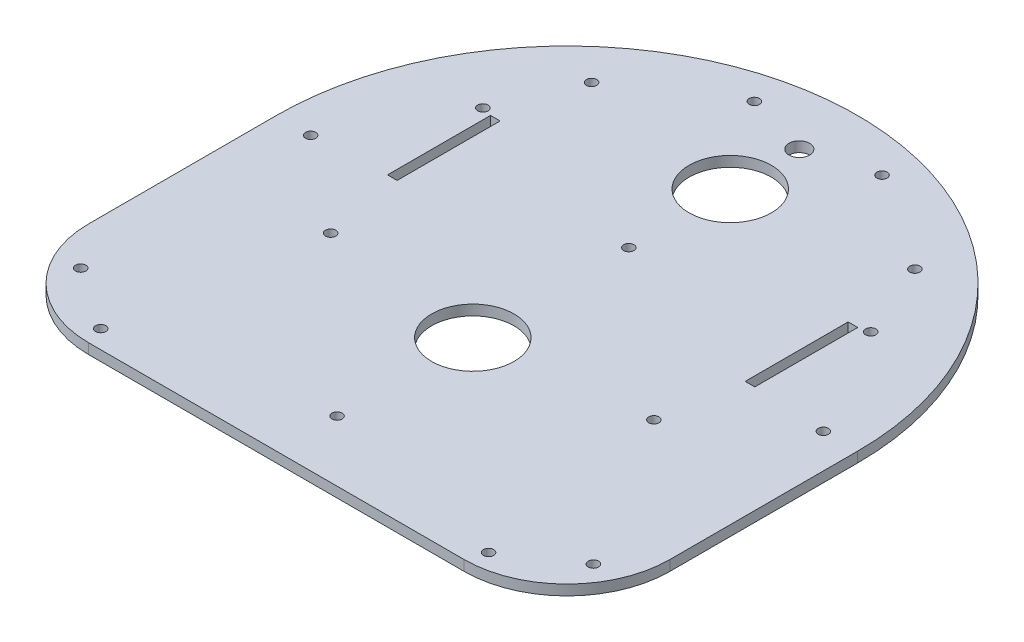
from build123d import *

# Parameters (mm, degrees)
SKETCH1_R           = 1.5
SKETCH1_R_2         = 12
SKETCH1_R_3         = 3
SKETCH1_W           = 2.8
SKETCH1_H           = 30
BOSS_EXTRUDE4_DEPTH = 3


with BuildPart() as part:
    # Sketch1 → Boss-Extrude4 (new body)
    with BuildSketch(Plane(origin=(0, 0, 0), x_dir=(1, 0, 0), z_dir=(0, 1, 0))):
        with BuildLine():
            Line((-121.196449229, -126.808304592), (-11.829794241, -126.808304592))
            ThreePointArc((-11.829794241, -126.808304592), (9.383409194, -118.021508028), (18.170205759, -96.808304592))
            Line((18.170205759, -96.808304592), (18.170205759, -42.124977099))
            ThreePointArc((18.170205759, -42.124977099), (-66.513121735, 42.558350395), (-151.196449229, -42.124977099))
            Line((-151.196449229, -42.124977099), (-151.196449229, -96.808304592))
            ThreePointArc((-151.196449229, -96.808304592), (-142.409652664, -118.021508028), (-121.196449229, -126.808304592))
        make_face()
        with Locations(Location((-19.417066349, 12.133998526, 0), (0, 0, 270))):
            Circle(SKETCH1_R, mode=Mode.SUBTRACT)
        with Locations(Location((-113.609177122, 12.133998526, 0), (0, 0, 270))):
            Circle(SKETCH1_R, mode=Mode.SUBTRACT)
        with Locations(Location((8.170205759, -42.124977099, 0), (0, 0, 270))):
            Circle(SKETCH1_R, mode=Mode.SUBTRACT)
        with Locations(Location((-141.196449229, -42.124977099, 0), (0, 0, 270))):
            Circle(SKETCH1_R, mode=Mode.SUBTRACT)
        with Locations(Location((-66.513121735, 5.435278237, 0), (0, 0, 270))):
            Circle(SKETCH1_R_2, mode=Mode.SUBTRACT)
        with Locations(Location((-66.513121735, 25.558350395, 0), (0, 0, 270))):
            Circle(SKETCH1_R_3, mode=Mode.SUBTRACT)
        with Locations(Location((-66.513121735, -69.564721763, 0), (0, 0, 270))):
            Circle(SKETCH1_R_2, mode=Mode.SUBTRACT)
        with Locations(Location((-123.013121735, -10.138406212, 0), (0, 0, 270))):
            Circle(SKETCH1_R, mode=Mode.SUBTRACT)
        with Locations(Location((-10.013121735, -10.138406212, 0), (0, 0, 270))):
            Circle(SKETCH1_R, mode=Mode.SUBTRACT)
        with Locations(Location((-10.013121735, -121.478406212, 0), (0, 0, 270))):
            Circle(SKETCH1_R, mode=Mode.SUBTRACT)
        with Locations(Location((-123.013121735, -121.478406212, 0), (0, 0, 270))):
            Circle(SKETCH1_R, mode=Mode.SUBTRACT)
        with Locations(Location((-66.513121735, -109.124977099, 0), (0, 0, 270))):
            Circle(SKETCH1_R, mode=Mode.SUBTRACT)
        with Locations(Location((-66.513121735, -24.124977099, 0), (0, 0, 270))):
            Circle(SKETCH1_R, mode=Mode.SUBTRACT)
        with Locations(Location((-141.196449229, -109.124977099, 0), (0, 0, 270))):
            Circle(SKETCH1_R, mode=Mode.SUBTRACT)
        with Locations(Location((8.170205759, -109.124977099, 0), (0, 0, 270))):
            Circle(SKETCH1_R, mode=Mode.SUBTRACT)
        with Locations(Location((-19.417066349, -63.912266725, 0), (0, 0, 270))):
            Circle(SKETCH1_R, mode=Mode.SUBTRACT)
        with Locations(Location((-113.609177122, -63.912266725, 0), (0, 0, 270))):
            Circle(SKETCH1_R, mode=Mode.SUBTRACT)
        with Locations(Location((-85.109177122, 31.058350391, 0), (0, 0, 270))):
            Circle(SKETCH1_R, mode=Mode.SUBTRACT)
        with Locations(Location((-47.917066349, 31.058350391, 0), (0, 0, 270))):
            Circle(SKETCH1_R, mode=Mode.SUBTRACT)
        with Locations((-14.413121735, -25.911649605)):
            Rectangle(SKETCH1_W, SKETCH1_H, mode=Mode.SUBTRACT)
        with Locations((-118.613121735, -25.911649605)):
            Rectangle(SKETCH1_W, SKETCH1_H, mode=Mode.SUBTRACT)
    extrude(amount=BOSS_EXTRUDE4_DEPTH)


solid = part.part
